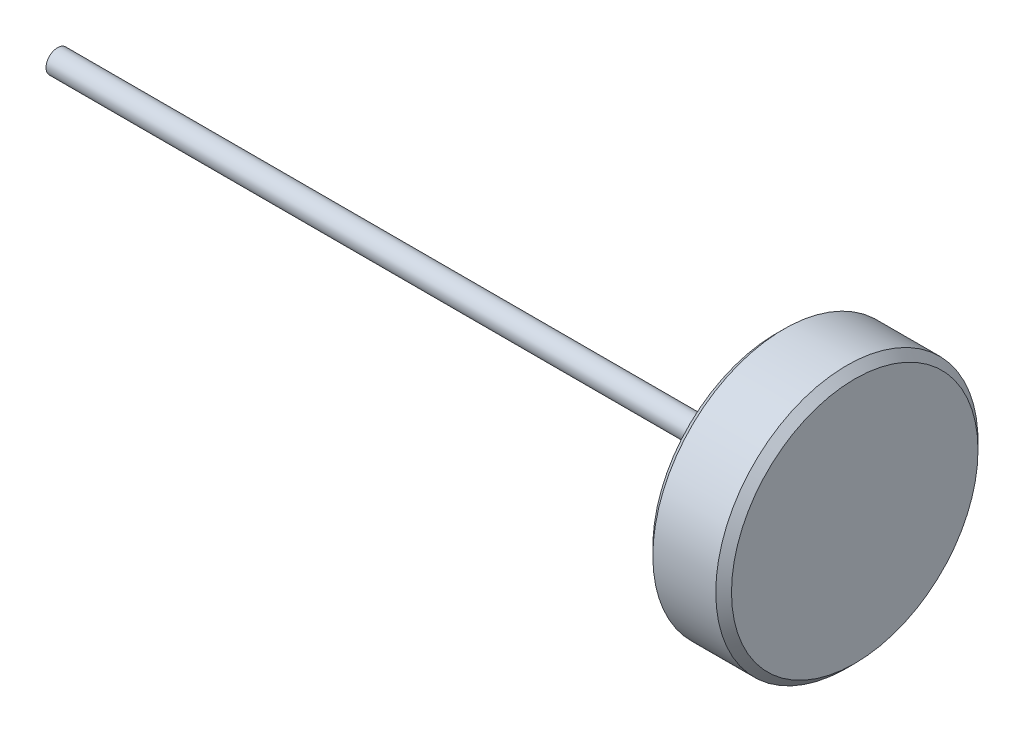
from build123d import *

# Parameters (mm, degrees)
SKETCH1_R           = 31.75
BOSS_EXTRUDE1_DEPTH = 19.05
SKETCH2_R           = 2.794
BOSS_EXTRUDE2_DEPTH = 173.99
FILLET1_R           = 4.445
CHAMFER1_SIZE       = 1.905


with BuildPart() as part:
    # Sketch1 → Boss-Extrude1 (new body)
    with BuildSketch(Plane(origin=(0, 0, 0), x_dir=(0, 0, -1), z_dir=(1, 0, 0))):
        with Locations(Location((0, 0, 0), (0, 0, 180))):
            Circle(SKETCH1_R)
    extrude(amount=BOSS_EXTRUDE1_DEPTH)

    # Sketch2 → Boss-Extrude2 (add)
    with BuildSketch(Plane.ZY):
        with Locations(Location((0, 0, 0), (0, 0, 180))):
            Circle(SKETCH2_R)
    extrude(amount=BOSS_EXTRUDE2_DEPTH)

    # Fillet1
    fillet1_edges = [part.edges().sort_by_distance(p)[0] for p in [
        (0, 0, 2.794),
    ]]
    fillet(fillet1_edges, radius=FILLET1_R)

    # Chamfer1
    chamfer1_edges = [part.edges().sort_by_distance(p)[0] for p in [
        (0, 0, -31.75),
        (19.05, 0, -31.75),
    ]]
    chamfer(chamfer1_edges, length=CHAMFER1_SIZE)


solid = part.part
